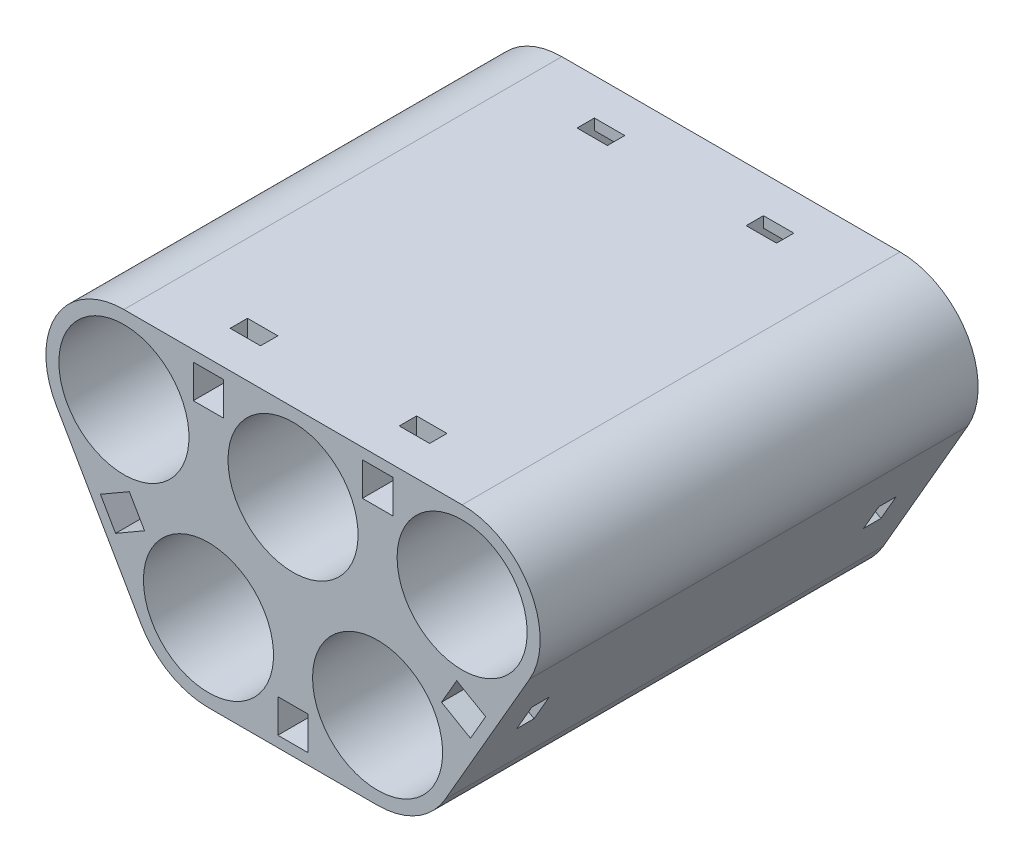
from build123d import *

# Parameters (mm, degrees)
SKETCH1_R               = 7.5
BOSS_EXTRUDE1_DEPTH     = 50.5
SKETCH2_W               = 2
SKETCH2_H               = 3.5
CUT_EXTRUDE1_DEPTH      = 1.5
SKETCH3_W               = 3.5
SKETCH3_H               = 2
CUT_EXTRUDE2_DEPTH      = 1.5
SKETCH4_W               = 3.5
SKETCH4_H               = 2
CUT_EXTRUDE3_DEPTH      = 1.5
SKETCH5_W               = 3.5
SKETCH5_H               = 3.854101966
CUT_EXTRUDE4_DEPTH      = 6.25
MIRROR3_COPY_1_SKETCH_W = 2
MIRROR3_COPY_1_SKETCH_H = 3.5
MIRROR3_COPY_1_DEPTH    = 1.5
MIRROR3_COPY_2_SKETCH_W = 3.5
MIRROR3_COPY_2_SKETCH_H = 2
MIRROR3_COPY_2_DEPTH    = 1.5
MIRROR3_COPY_3_SKETCH_W = 3.5
MIRROR3_COPY_3_SKETCH_H = 2
MIRROR3_COPY_3_DEPTH    = 1.5
MIRROR3_COPY_4_SKETCH_W = 3.5
MIRROR3_COPY_4_SKETCH_H = 3.854101966
MIRROR3_COPY_4_DEPTH    = 6.25


with BuildPart() as part:
    # Sketch1 → Boss-Extrude1 (new body)
    with BuildSketch(Plane.XY):
        with BuildLine():
            Line((0, 9), (39, 9))
            ThreePointArc((39, 9), (46.794228634, 4.5), (46.794228634, -4.5))
            Line((46.794228634, -4.5), (37.044228634, -21.387495374))
            ThreePointArc((37.044228634, -21.387495374), (33.75, -24.681724008), (29.25, -25.887495374))
            Line((29.25, -25.887495374), (9.75, -25.887495374))
            ThreePointArc((9.75, -25.887495374), (5.25, -24.681724008), (1.955771366, -21.387495374))
            Line((1.955771366, -21.387495374), (-7.794228634, -4.5))
            ThreePointArc((-7.794228634, -4.5), (-7.794228634, 4.5), (0, 9))
        make_face()
        with Locations(Location((0, 0, 0), (0, 0, 180))):
            Circle(SKETCH1_R, mode=Mode.SUBTRACT)
        with Locations(Location((9.75, -16.887495374, 0), (0, 0, 180))):
            Circle(SKETCH1_R, mode=Mode.SUBTRACT)
        with Locations(Location((19.5, 0, 0), (0, 0, 180))):
            Circle(SKETCH1_R, mode=Mode.SUBTRACT)
        with Locations(Location((39, 0, 0), (0, 0, 180))):
            Circle(SKETCH1_R, mode=Mode.SUBTRACT)
        with Locations(Location((29.25, -16.887495374, 0), (0, 0, 180))):
            Circle(SKETCH1_R, mode=Mode.SUBTRACT)
    extrude(amount=BOSS_EXTRUDE1_DEPTH)

    # Sketch2 → Cut-Extrude1 (cut)
    with BuildSketch(Plane(origin=(37.044228634, -21.387495374, 0), x_dir=(0, 0, -1), z_dir=(0.8660254037844384, -0.5000000000000007, 0))):
        with Locations((-5.25, 9.75)):
            Rectangle(SKETCH2_W, SKETCH2_H)
    cut_extrude1 = extrude(amount=-CUT_EXTRUDE1_DEPTH, mode=Mode.SUBTRACT)

    # Sketch3 → Cut-Extrude2 (cut)
    with BuildSketch(Plane(origin=(0, 9, 0), x_dir=(1, 0, 0), z_dir=(0, 1, 0))):
        with Locations((29.25, -5.25)):
            Rectangle(SKETCH3_W, SKETCH3_H)
    cut_extrude2 = extrude(amount=-CUT_EXTRUDE2_DEPTH, mode=Mode.SUBTRACT)

    # Sketch4 → Cut-Extrude3 (cut)
    with BuildSketch(Plane.XZ.offset(25.887495374)):
        with Locations((19.5, 5.25)):
            Rectangle(SKETCH4_W, SKETCH4_H)
    cut_extrude3 = extrude(amount=-CUT_EXTRUDE3_DEPTH, mode=Mode.SUBTRACT)

    # Sketch5 → Cut-Extrude4 (cut)
    with BuildSketch(Plane(origin=(0, 0, 0), x_dir=(-1, 0, 0), z_dir=(0, 0, -1))):
        with Locations((-29.25, 5.822949017)):
            Rectangle(SKETCH5_W, SKETCH5_H)
        with Locations((-19.5, -22.710444391)):
            Rectangle(SKETCH5_W, SKETCH5_H)
        Polygon((-38.373946668, -8.876152247), (-36.623946668, -11.90724116), (-39.961696879, -13.834292144), (-41.711696879, -10.80320323), align=None)
    cut_extrude4 = extrude(amount=-CUT_EXTRUDE4_DEPTH, mode=Mode.SUBTRACT)

    # Mirror2: Cut-Extrude1, Cut-Extrude2, Cut-Extrude3, Cut-Extrude4 across plane
    add(cut_extrude1.mirror(Plane(origin=(19.5, 0, 0), x_dir=(0, 0, 1), z_dir=(1, 0, 0))), mode=Mode.SUBTRACT)
    add(cut_extrude2.mirror(Plane(origin=(19.5, 0, 0), x_dir=(0, 0, 1), z_dir=(1, 0, 0))), mode=Mode.SUBTRACT)
    add(cut_extrude3.mirror(Plane(origin=(19.5, 0, 0), x_dir=(0, 0, 1), z_dir=(1, 0, 0))), mode=Mode.SUBTRACT)
    add(cut_extrude4.mirror(Plane(origin=(19.5, 0, 0), x_dir=(0, 0, 1), z_dir=(1, 0, 0))), mode=Mode.SUBTRACT)

    # Mirror3: Cut-Extrude1, Cut-Extrude2, Cut-Extrude3, Cut-Extrude4 across plane
    add(cut_extrude1.mirror(Plane(origin=(0, 0, 25.25), x_dir=(1, 0, 0), z_dir=(0, 0, -1))), mode=Mode.SUBTRACT)
    add(cut_extrude2.mirror(Plane(origin=(0, 0, 25.25), x_dir=(1, 0, 0), z_dir=(0, 0, -1))), mode=Mode.SUBTRACT)
    add(cut_extrude3.mirror(Plane(origin=(0, 0, 25.25), x_dir=(1, 0, 0), z_dir=(0, 0, -1))), mode=Mode.SUBTRACT)
    add(cut_extrude4.mirror(Plane(origin=(0, 0, 25.25), x_dir=(1, 0, 0), z_dir=(0, 0, -1))), mode=Mode.SUBTRACT)

    # Mirror3 copy 1 sketch → Mirror3 copy 1 (cut)
    with BuildSketch(Plane(origin=(1.955771366, -21.387495374, 50.5), x_dir=(0, 0, 1), z_dir=(-0.8660254037844385, -0.5000000000000004, 0))):
        with Locations((-5.25, 9.75)):
            Rectangle(MIRROR3_COPY_1_SKETCH_W, MIRROR3_COPY_1_SKETCH_H)
    extrude(amount=-MIRROR3_COPY_1_DEPTH, mode=Mode.SUBTRACT)

    # Mirror3 copy 2 sketch → Mirror3 copy 2 (cut)
    with BuildSketch(Plane(origin=(39, 9, 50.5), x_dir=(-1, 0, 0), z_dir=(0, 1, 0))):
        with Locations((29.25, -5.25)):
            Rectangle(MIRROR3_COPY_2_SKETCH_W, MIRROR3_COPY_2_SKETCH_H)
    extrude(amount=-MIRROR3_COPY_2_DEPTH, mode=Mode.SUBTRACT)

    # Mirror3 copy 3 sketch → Mirror3 copy 3 (cut)
    with BuildSketch(Plane(origin=(39, -25.887495374, 50.5), x_dir=(-1, 0, 0), z_dir=(0, -1, 0))):
        with Locations((19.5, 5.25)):
            Rectangle(MIRROR3_COPY_3_SKETCH_W, MIRROR3_COPY_3_SKETCH_H)
    extrude(amount=-MIRROR3_COPY_3_DEPTH, mode=Mode.SUBTRACT)

    # Mirror3 copy 4 sketch → Mirror3 copy 4 (cut)
    with BuildSketch(Plane(origin=(39, 0, 50.5), x_dir=(1, 0, 0), z_dir=(0, 0, 1))):
        with Locations((-29.25, 5.822949017)):
            Rectangle(MIRROR3_COPY_4_SKETCH_W, MIRROR3_COPY_4_SKETCH_H)
        with Locations((-19.5, -22.710444391)):
            Rectangle(MIRROR3_COPY_4_SKETCH_W, MIRROR3_COPY_4_SKETCH_H)
        Polygon((-38.373946668, -8.876152247), (-36.623946668, -11.90724116), (-39.961696879, -13.834292144), (-41.711696879, -10.80320323), align=None)
    extrude(amount=-MIRROR3_COPY_4_DEPTH, mode=Mode.SUBTRACT)


solid = part.part
